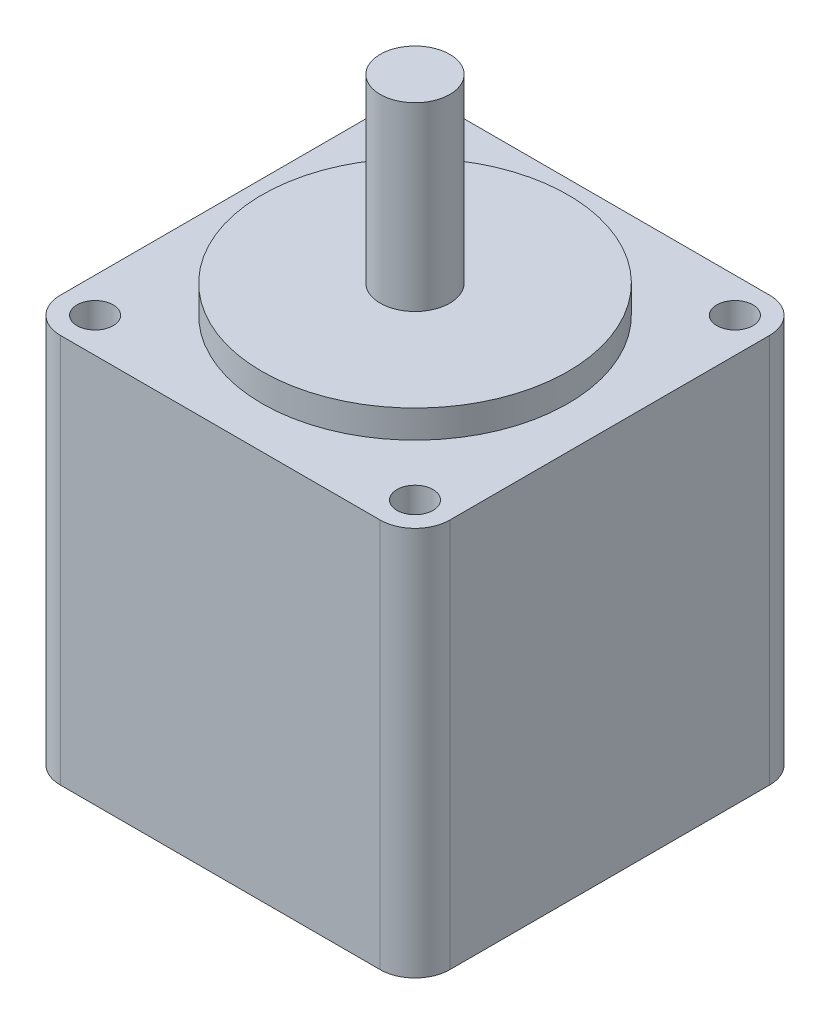
from build123d import *

# Parameters (mm, degrees)
EXTRUDE_1_DEPTH     = 28
SKETCH_2_R          = 11
EXTRUDE_2_DEPTH     = 2
SKETCH_3_R          = 2.5
EXTRUDE_3_DEPTH     = 13
SKETCH_4_R          = 1.3
CUT_EXTRUDE_1_DEPTH = 5


with BuildPart() as part:
    # 草图1 → 凸台-拉伸1 (new body)
    with BuildSketch(Plane(origin=(0, 0, 0), x_dir=(1, 0, 0), z_dir=(0, 1, 0))):
        with BuildLine():
            Line((-11.5, 14), (11.5, 14))
            ThreePointArc((11.5, 14), (13.267766953, 13.267766953), (14, 11.5))
            Line((14, 11.5), (14, -11.5))
            ThreePointArc((14, -11.5), (13.267766953, -13.267766953), (11.5, -14))
            Line((11.5, -14), (-11.5, -14))
            ThreePointArc((-11.5, -14), (-13.267766953, -13.267766953), (-14, -11.5))
            Line((-14, -11.5), (-14, 11.5))
            ThreePointArc((-14, 11.5), (-13.267766953, 13.267766953), (-11.5, 14))
        make_face()
    extrude(amount=EXTRUDE_1_DEPTH)

    # 草图2 → 凸台-拉伸2 (add)
    with BuildSketch(Plane(origin=(0, 28, 0), x_dir=(-1, 0, 0), z_dir=(0, 1, 0))):
        with Locations(Location((0, 0, 0), (0, 0, 90))):
            Circle(SKETCH_2_R)
    extrude(amount=EXTRUDE_2_DEPTH)

    # 草图3 → 凸台-拉伸3 (add)
    with BuildSketch(Plane(origin=(0, 30, 0), x_dir=(-1, 0, 0), z_dir=(0, 1, 0))):
        with Locations(Location((0, 0, 0), (0, 0, 270))):
            Circle(SKETCH_3_R)
    extrude(amount=EXTRUDE_3_DEPTH)

    # 草图4 → 切除-拉伸1 (cut)
    with BuildSketch(Plane(origin=(0, 28, 0), x_dir=(-1, 0, 0), z_dir=(0, 1, 0))):
        with Locations(Location((11.5, 11.5, 0), (0, 0, 90))):
            Circle(SKETCH_4_R)
        with Locations(Location((11.5, -11.5, 0), (0, 0, 90))):
            Circle(SKETCH_4_R)
        with Locations(Location((-11.5, -11.5, 0), (0, 0, 90))):
            Circle(SKETCH_4_R)
        with Locations(Location((-11.5, 11.5, 0), (0, 0, 90))):
            Circle(SKETCH_4_R)
    extrude(amount=-CUT_EXTRUDE_1_DEPTH, mode=Mode.SUBTRACT)


solid = part.part
